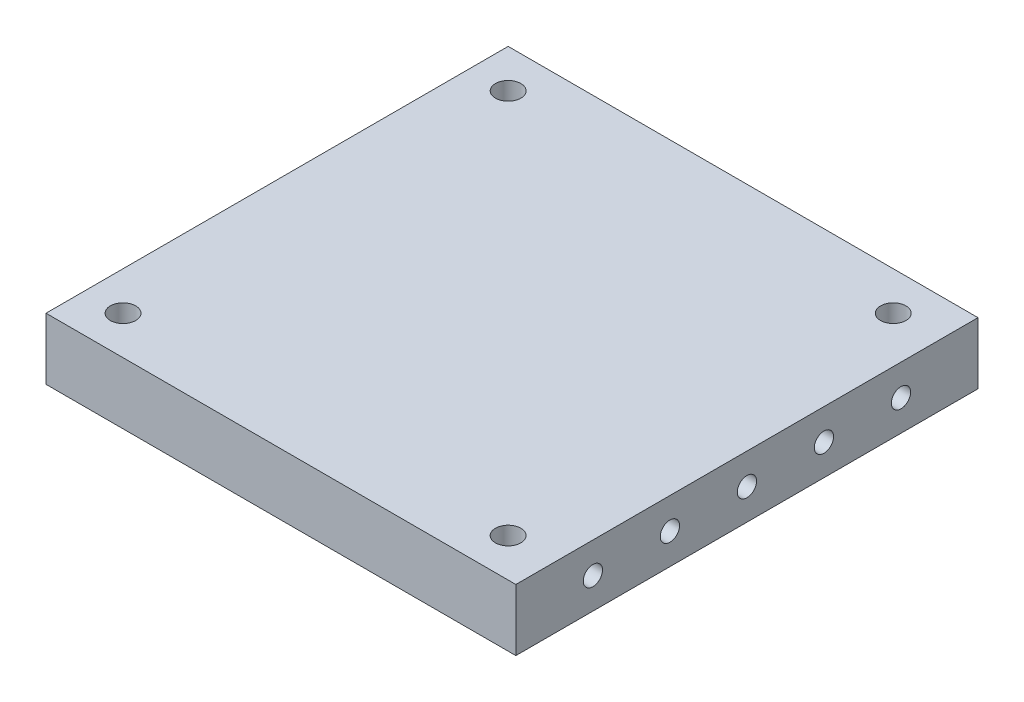
from build123d import *

# Parameters (mm, degrees)
SKETCH_1_W          = 60
SKETCH_1_H          = 60
EXTRUDE_1_DEPTH     = 8
SKETCH_2_R          = 1.65
CUT_EXTRUDE_1_DEPTH = 8
SKETCH_3_W          = 1
SKETCH_3_H          = 60
EXTRUDE_2_DEPTH     = 8
SKETCH_7_R          = 1.25
CUT_EXTRUDE_2_DEPTH = 9


with BuildPart() as part:
    # 草图1 → 凸台-拉伸1 (new body)
    with BuildSketch(Plane(origin=(0, 0, 0), x_dir=(1, 0, 0), z_dir=(0, 1, 0))):
        with Locations((30, -30)):
            Rectangle(SKETCH_1_W, SKETCH_1_H)
    extrude(amount=EXTRUDE_1_DEPTH)

    # 草图2 → 切除-拉伸1 (cut)
    with BuildSketch(Plane(origin=(0, 8, 0), x_dir=(1, 0, 0), z_dir=(0, 1, 0))):
        with Locations(Location((5, -5, 0), (0, 0, 270))):
            Circle(SKETCH_2_R)
        with Locations(Location((55, -5, 0), (0, 0, 270))):
            Circle(SKETCH_2_R)
        with Locations(Location((5, -55, 0), (0, 0, 270))):
            Circle(SKETCH_2_R)
        with Locations(Location((55, -55, 0), (0, 0, 270))):
            Circle(SKETCH_2_R)
    extrude(amount=-CUT_EXTRUDE_1_DEPTH, mode=Mode.SUBTRACT)

    # 草图3 → 凸台-拉伸2 (add)
    with BuildSketch(Plane(origin=(0, 8, 0), x_dir=(1, 0, 0), z_dir=(0, 1, 0))):
        with Locations((60.5, -30)):
            Rectangle(SKETCH_3_W, SKETCH_3_H)
    extrude(amount=-EXTRUDE_2_DEPTH)

    # 草图7 → 切除-拉伸2 (cut)
    with BuildSketch(Plane(origin=(61, 0, 0), x_dir=(0, 0, -1), z_dir=(1, 0, 0))):
        with Locations((-50, 4)):
            Circle(SKETCH_7_R)
        with Locations((-40, 4)):
            Circle(SKETCH_7_R)
        with Locations((-30, 4)):
            Circle(SKETCH_7_R)
        with Locations((-10, 4)):
            Circle(SKETCH_7_R)
        with Locations((-20, 4)):
            Circle(SKETCH_7_R)
    extrude(amount=-CUT_EXTRUDE_2_DEPTH, mode=Mode.SUBTRACT)


solid = part.part
